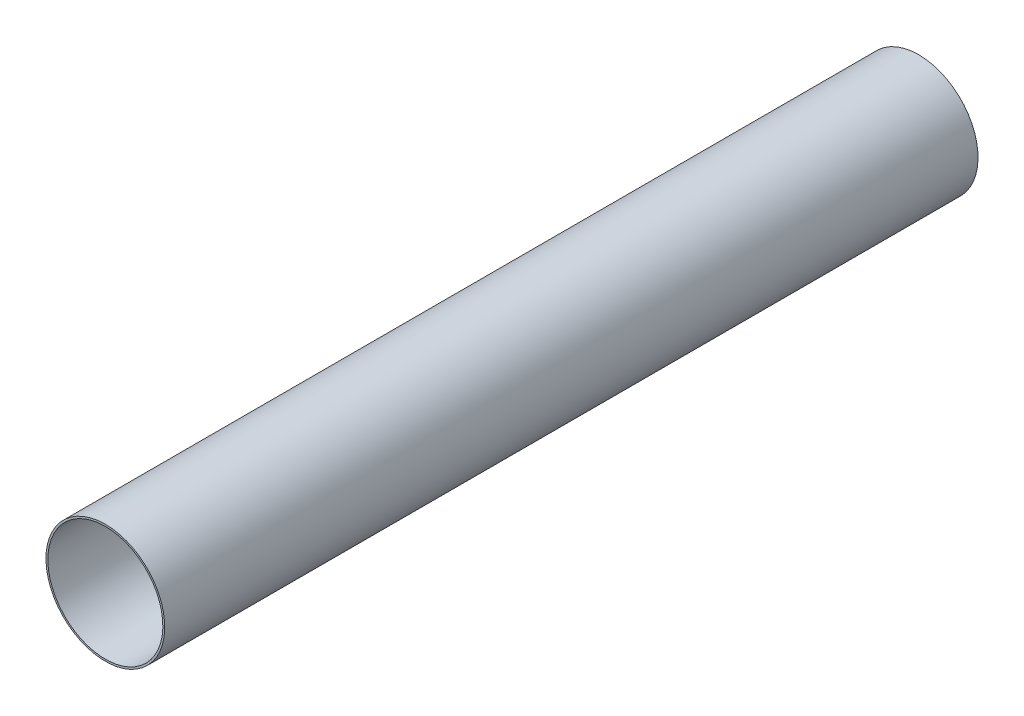
from build123d import *

# Parameters (mm, degrees)
ESQUISSE2_W = 700
ESQUISSE2_H = 1.6


with BuildPart() as part:
    # Esquisse2 → Révolution1 (revolve)
    with BuildSketch(Plane(origin=(0, 0, 0), x_dir=(0, 0, -1), z_dir=(1, 0, 0))):
        with Locations((-360, 50.3)):
            Rectangle(ESQUISSE2_W, ESQUISSE2_H)
    revolve(axis=Axis((0, 0, 0), (0, 0, 1)))


solid = part.part
